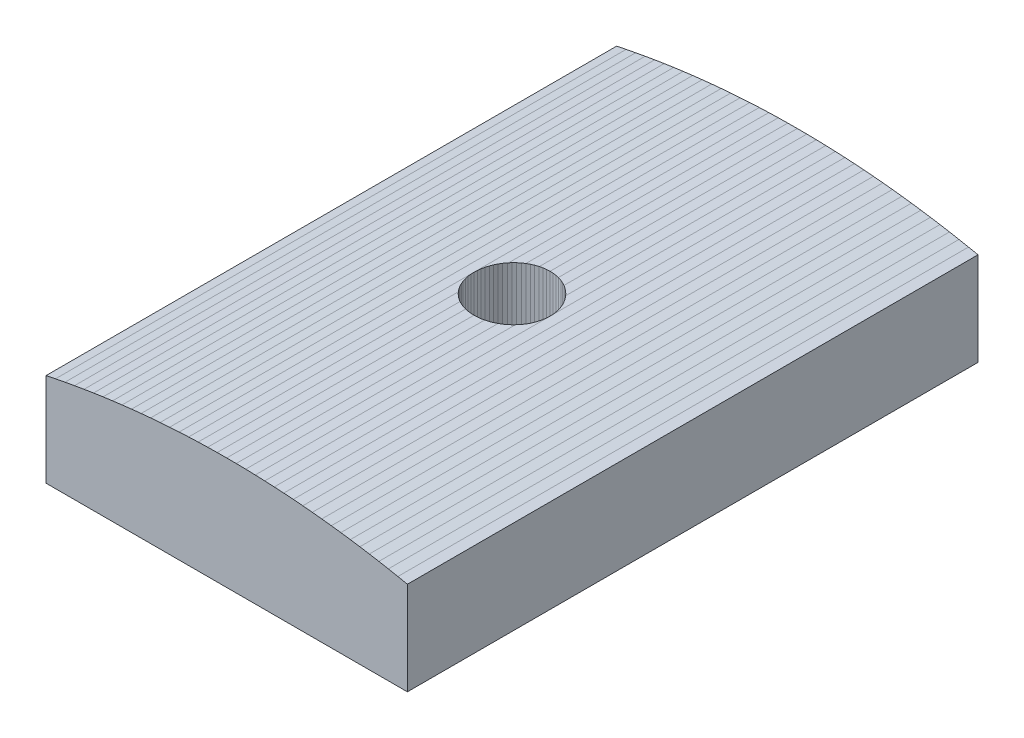
from build123d import *

# Parameters (mm, degrees)
ARCHED_FLOAT_DEPTH             = 600
TETHER_PASS_THROUGH_DEPTH      = 665.752585553
TETHER_PASS_THROUGH_DEPTH_BACK = 665.752585553


with BuildPart() as part:
    # 草图1 → Arched_float (new body)
    with BuildSketch(Plane.XY):
        Polygon((-190, 96), (190, 96), (190, 194), (180, 196.049861496), (170, 197.988919668), (160, 199.817174515), (150, 201.534626039), (140, 203.141274238), (130, 204.637119114), (120, 206.022160665), (110, 207.296398892), (100, 208.459833795), (90, 209.512465374), (80, 210.454293629), (70, 211.28531856), (60, 212.005540166), (50, 212.614958449), (40, 213.113573407), (30, 213.501385042), (20, 213.778393352), (10, 213.944598338), (0, 214), (-10, 213.944598338), (-20, 213.778393352), (-30, 213.501385042), (-40, 213.113573407), (-50, 212.614958449), (-60, 212.005540166), (-70, 211.28531856), (-80, 210.454293629), (-90, 209.512465374), (-100, 208.459833795), (-110, 207.296398892), (-120, 206.022160665), (-130, 204.637119114), (-140, 203.141274238), (-150, 201.534626039), (-160, 199.817174515), (-170, 197.988919668), (-180, 196.049861496), (-190, 194), align=None)
    extrude(amount=ARCHED_FLOAT_DEPTH)

    # 草图2 → Tether_pass_through (cut, two sides: drawn at the far end of the back side and taken through both)
    with BuildSketch(Plane(origin=(0, 0, 0), x_dir=(1, 0, 0), z_dir=(0, 1, 0)).offset(-TETHER_PASS_THROUGH_DEPTH_BACK)):
        Polygon((40, -300), (39.847787924, -303.48622971), (39.39231012, -306.945927107), (38.637033052, -310.352761804), (37.587704831, -313.680805733), (36.252311481, -316.90473047), (34.641016151, -320), (32.766081772, -322.943057454), (30.641777725, -325.711504387), (28.284271247, -328.284271247), (25.711504387, -330.641777725), (22.943057454, -332.766081772), (20, -334.641016151), (16.90473047, -336.252311481), (13.680805733, -337.587704831), (10.352761804, -338.637033052), (6.945927107, -339.39231012), (3.48622971, -339.847787924), (0, -340), (-3.48622971, -339.847787924), (-6.945927107, -339.39231012), (-10.352761804, -338.637033052), (-13.680805733, -337.587704831), (-16.90473047, -336.252311481), (-20, -334.641016151), (-22.943057454, -332.766081772), (-25.711504387, -330.641777725), (-28.284271247, -328.284271247), (-30.641777725, -325.711504387), (-32.766081772, -322.943057454), (-34.641016151, -320), (-36.252311481, -316.90473047), (-37.587704831, -313.680805733), (-38.637033052, -310.352761804), (-39.39231012, -306.945927107), (-39.847787924, -303.48622971), (-40, -300), (-39.847787924, -296.51377029), (-39.39231012, -293.054072893), (-38.637033052, -289.647238196), (-37.587704831, -286.319194267), (-36.252311481, -283.09526953), (-34.641016151, -280), (-32.766081772, -277.056942546), (-30.641777725, -274.288495613), (-28.284271247, -271.715728753), (-25.711504387, -269.358222275), (-22.943057454, -267.233918228), (-20, -265.358983849), (-16.90473047, -263.747688519), (-13.680805733, -262.412295169), (-10.352761804, -261.362966948), (-6.945927107, -260.60768988), (-3.48622971, -260.152212076), (0, -260), (3.48622971, -260.152212076), (6.945927107, -260.60768988), (10.352761804, -261.362966948), (13.680805733, -262.412295169), (16.90473047, -263.747688519), (20, -265.358983849), (22.943057454, -267.233918228), (25.711504387, -269.358222275), (28.284271247, -271.715728753), (30.641777725, -274.288495613), (32.766081772, -277.056942546), (34.641016151, -280), (36.252311481, -283.09526953), (37.587704831, -286.319194267), (38.637033052, -289.647238196), (39.39231012, -293.054072893), (39.847787924, -296.51377029), align=None)
    extrude(amount=TETHER_PASS_THROUGH_DEPTH + TETHER_PASS_THROUGH_DEPTH_BACK, mode=Mode.SUBTRACT)


solid = part.part
